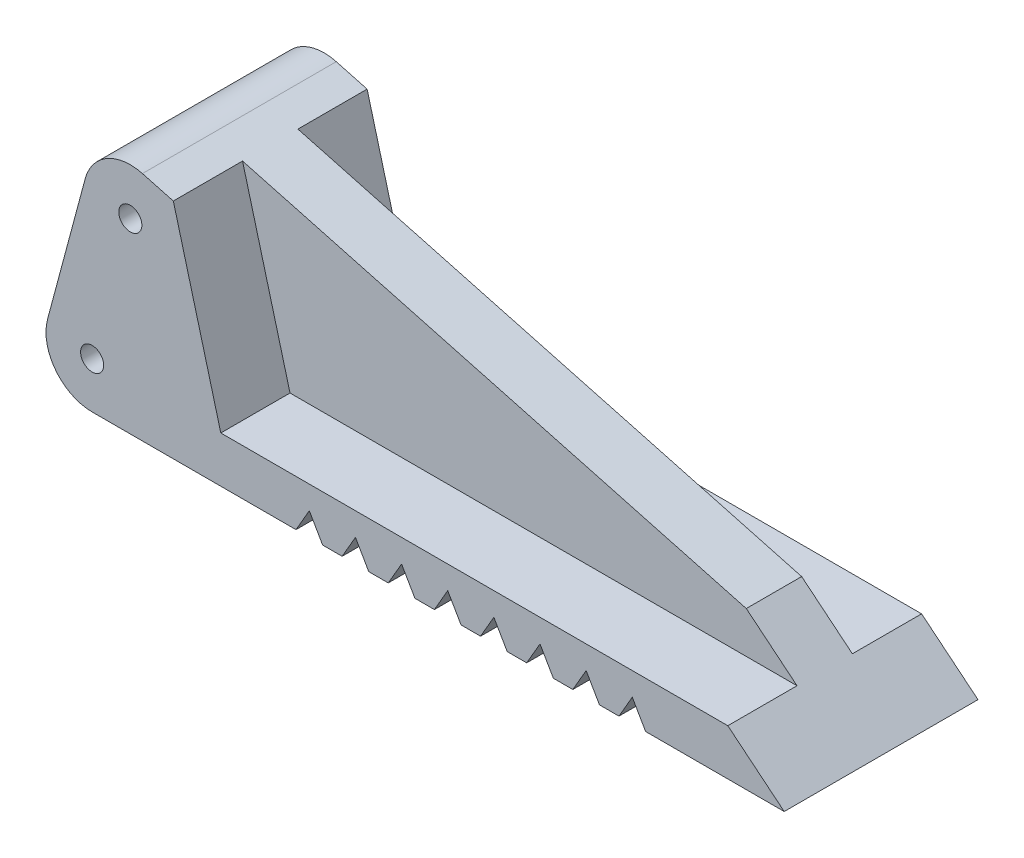
from build123d import *

# Parameters (mm, degrees)
SKETCH_1_R             = 2.5
EXTRUDE_1_DEPTH        = 21
CUT_EXTRUDE_1_DEPTH    = 11
CUT_EXTRUDE_2_DEPTH    = 15
CUT_EXTRUDE_3_DEPTH    = 25
PATTERN_LINEAR_1_COUNT = 8
PATTERN_LINEAR_1_PITCH = 10


with BuildPart() as part:
    # 草图1 → 凸台-拉伸1 (new, symmetric)
    with BuildSketch(Plane.XY):
        with BuildLine():
            Line((218.502541787, 68.048442919), (210.340741737, 37.588190451))
            ThreePointArc((210.340741737, 37.588190451), (212.066466597, 28.91238571), (220, 25))
            Line((220, 25), (358.547941324, 25))
            Line((358.547941324, 25), (370, 25))
            Line((370, 25), (346.78040334, 43.996060933))
            Line((346.78040334, 43.996060933), (230.908606215, 75.200654039))
            ThreePointArc((230.908606215, 75.200654039), (223.222977943, 74.196224157), (218.502541787, 68.048442919))
        make_face()
        with Locations(Location((220, 35, 0), (0, 0, 180))):
            Circle(SKETCH_1_R, mode=Mode.SUBTRACT)
        with Locations(Location((228.27716468, 65.429340608, 0), (0, 0, 180))):
            Circle(SKETCH_1_R, mode=Mode.SUBTRACT)
    extrude(amount=EXTRUDE_1_DEPTH, both=True)

    # 草图2 → 切除-拉伸1 (cut, symmetric)
    with BuildSketch(Plane.XY):
        with BuildLine():
            Line((235, 20), (235, 35))
            ThreePointArc((235, 35), (230.606601718, 45.606601718), (220, 50))
            Line((220, 50), (205, 50))
            Line((205, 50), (205.078251443, 33.469830071))
            Line((205.078251443, 33.469830071), (205.078251443, 20))
            Line((205.078251443, 20), (235, 20))
        make_face()
    extrude(amount=CUT_EXTRUDE_1_DEPTH, both=True, mode=Mode.SUBTRACT)

    # 草图3 → 切除-拉伸2 (cut)
    with BuildSketch(Plane.XY.offset(21)):
        Polygon((237.599806566, 73.398695413), (247.888705992, 35), (366.823980308, 35), (338.386105999, 70.333701244), align=None)
    cut_extrude_2 = extrude(amount=-CUT_EXTRUDE_2_DEPTH, mode=Mode.SUBTRACT)

    # 镜向1: 切除-拉伸2 across plane
    add(cut_extrude_2.mirror(Plane.XY), mode=Mode.SUBTRACT)

    # 草图4 → 切除-拉伸3 (cut, symmetric)
    with BuildSketch(Plane.XY):
        Polygon((262.071941238, 21.339745962), (267.071941238, 30), (272.071941238, 21.339745962), align=None)
    cut_extrude_3 = extrude(amount=CUT_EXTRUDE_3_DEPTH, both=True, mode=Mode.SUBTRACT)

    # 阵列(线性)1: 切除-拉伸3 ×8
    with Locations(*[(i * PATTERN_LINEAR_1_PITCH, 0, 0) for i in range(1, PATTERN_LINEAR_1_COUNT)]):
        add(cut_extrude_3, mode=Mode.SUBTRACT)


solid = part.part
